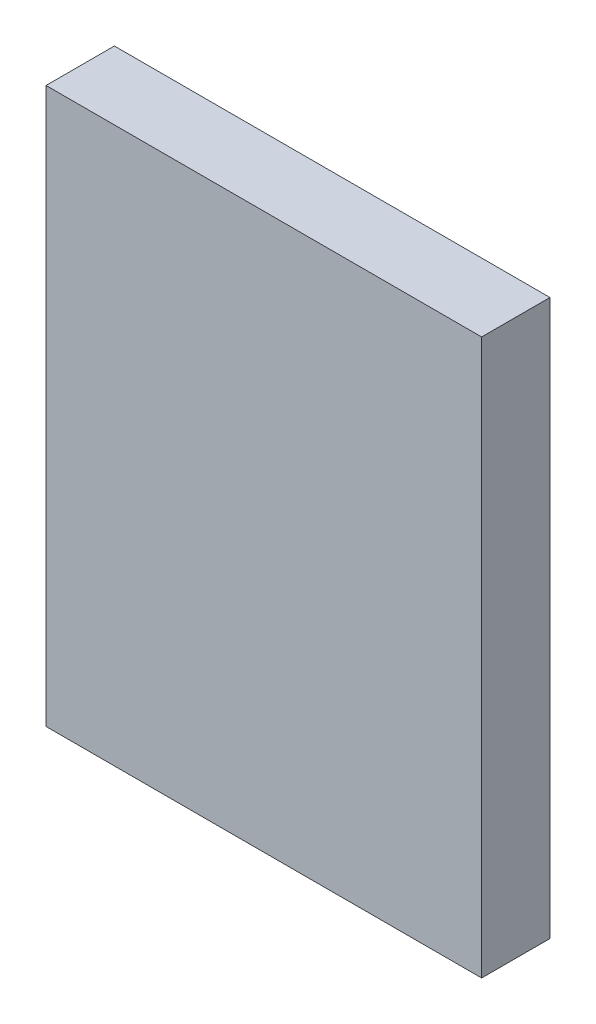
from build123d import *

# Parameters (mm, degrees)
ESQUISSE1_W        = 51
ESQUISSE1_H        = 65
BOSS_EXTRU_1_DEPTH = 8


with BuildPart() as part:
    # Esquisse1 → Boss.-Extru.1 (new body)
    with BuildSketch(Plane.XY):
        with Locations((-0.389063848, -12.927631579)):
            Rectangle(ESQUISSE1_W, ESQUISSE1_H)
    extrude(amount=BOSS_EXTRU_1_DEPTH)


solid = part.part
